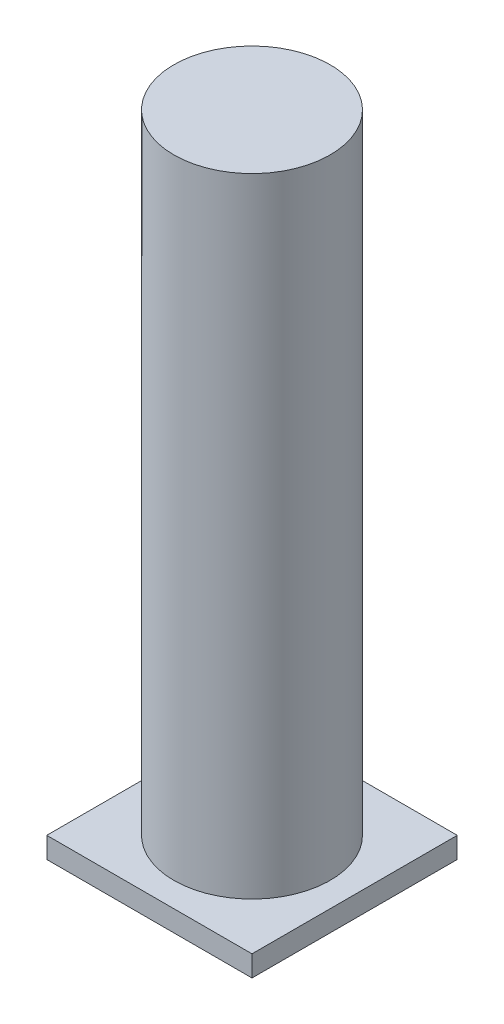
from build123d import *

# Parameters (mm, degrees)
SKETCH1_W           = 4.9
SKETCH1_H           = 4.9
BOSS_EXTRUDE1_DEPTH = 0.5
SKETCH2_R           = 1.865605767
BOSS_EXTRUDE3_DEPTH = 15


with BuildPart() as part:
    # Sketch1 → Boss-Extrude1 (new body)
    with BuildSketch(Plane(origin=(0, 0, 0), x_dir=(1, 0, 0), z_dir=(0, 1, 0))):
        Rectangle(SKETCH1_W, SKETCH1_H)
    extrude(amount=BOSS_EXTRUDE1_DEPTH)

    # Sketch2 → Boss-Extrude3 (add)
    with BuildSketch(Plane(origin=(0, 0.5, 0), x_dir=(1, 0, 0), z_dir=(0, 1, 0))):
        with Locations(Location((0, 0, 0), (0, 0, 270))):
            Circle(SKETCH2_R)
    extrude(amount=BOSS_EXTRUDE3_DEPTH)


solid = part.part
